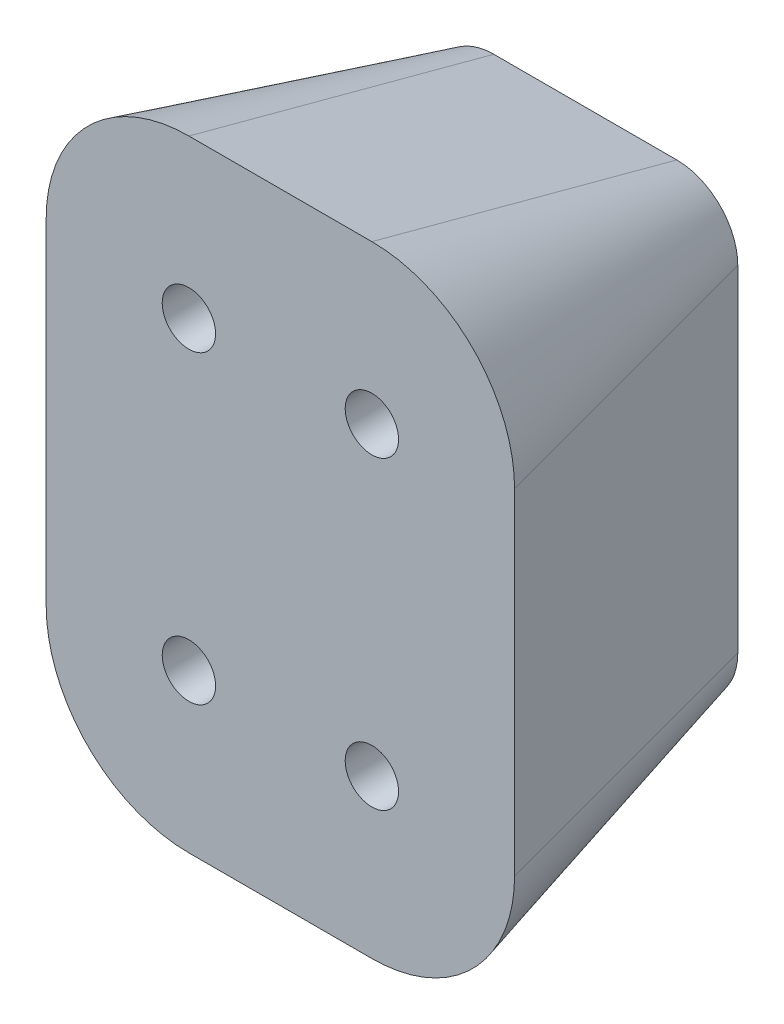
from build123d import *

# Parameters (mm, degrees)
SKETCH1_R           = 1.75
BOSS_EXTRUDE1_DEPTH = 5
BOSS_EXTRUDE2_DEPTH = 20
BOSS_EXTRUDE2_DRAFT = -15
CUT_EXTRUDE1_REACH  = 37.713
SKETCH5_R           = 1.75
CUT_EXTRUDE2_DEPTH  = 5


with BuildPart() as part:
    # Sketch1 → Boss-Extrude1 (new body)
    with BuildSketch(Plane.XY):
        with BuildLine():
            Line((-6, 15), (6, 15))
            ThreePointArc((6, 15), (8.828427125, 13.828427125), (10, 11))
            Line((10, 11), (10, -11))
            ThreePointArc((10, -11), (8.828427125, -13.828427125), (6, -15))
            Line((6, -15), (-6, -15))
            ThreePointArc((-6, -15), (-8.828427125, -13.828427125), (-10, -11))
            Line((-10, -11), (-10, 11))
            ThreePointArc((-10, 11), (-8.828427125, 13.828427125), (-6, 15))
        make_face()
        with Locations((-6, 10)):
            Circle(SKETCH1_R, mode=Mode.SUBTRACT)
        with Locations((6, 10)):
            Circle(SKETCH1_R, mode=Mode.SUBTRACT)
        with Locations((-6, -10)):
            Circle(SKETCH1_R, mode=Mode.SUBTRACT)
        with Locations((6, -10)):
            Circle(SKETCH1_R, mode=Mode.SUBTRACT)
    extrude(amount=BOSS_EXTRUDE1_DEPTH)


with BuildPart() as boss_extrude2_tool:
    # Sketch4 → Boss-Extrude2 (with draft: the straight prism first)
    with BuildSketch(Plane.XY.offset(5)):
        with BuildLine():
            Line((-6, -15), (6, -15))
            ThreePointArc((6, -15), (8.828427125, -13.828427125), (10, -11))
            Line((10, -11), (10, 11))
            ThreePointArc((10, 11), (8.828427125, 13.828427125), (6, 15))
            Line((6, 15), (-6, 15))
            ThreePointArc((-6, 15), (-8.828427125, 13.828427125), (-10, 11))
            Line((-10, 11), (-10, -11))
            ThreePointArc((-10, -11), (-8.828427125, -13.828427125), (-6, -15))
        make_face()
    extrude(amount=BOSS_EXTRUDE2_DEPTH)
    # Boss-Extrude2: the draft: its side faces are tilted about the plane it starts from
    boss_extrude2_sides = [boss_extrude2_tool.faces().sort_by_distance(p)[0] for p in [
        (-10, 0, 15),
        (-8.828427125, -13.828427125, 15),
        (0, -15, 15),
        (8.828427125, -13.828427125, 15),
        (10, 0, 15),
        (8.828427125, 13.828427125, 15),
        (0, 15, 15),
        (-8.828427125, 13.828427125, 15),
    ]]
    draft(boss_extrude2_sides, Plane.XY.offset(5), BOSS_EXTRUDE2_DRAFT)


with BuildPart() as part_1:
    add(part.part)

    # Boss-Extrude2: add boss_extrude2_tool
    add(boss_extrude2_tool.part)

    # Sketch5 → Cut-Extrude1 (cut, up to next)
    with BuildSketch(Plane(origin=(0, 0, 0), x_dir=(-1, 0, 0), z_dir=(0, 0, -1)), mode=Mode.PRIVATE) as cut_extrude1_sk1:
        with Locations(Location((-6, -10, 0), (0, 0, 180))):
            Circle(SKETCH5_R)
    cut_extrude1_tool1 = extrude(cut_extrude1_sk1.sketch, amount=-CUT_EXTRUDE1_REACH, mode=Mode.PRIVATE) & part_1.part
    # Sketch5 → Cut-Extrude1 (cut, up to next)
    with BuildSketch(Plane(origin=(0, 0, 0), x_dir=(-1, 0, 0), z_dir=(0, 0, -1)), mode=Mode.PRIVATE) as cut_extrude1_sk2:
        with Locations(Location((6, -10, 0), (0, 0, 180))):
            Circle(SKETCH5_R)
    cut_extrude1_tool2 = extrude(cut_extrude1_sk2.sketch, amount=-CUT_EXTRUDE1_REACH, mode=Mode.PRIVATE) & part_1.part
    # Sketch5 → Cut-Extrude1 (cut, up to next)
    with BuildSketch(Plane(origin=(0, 0, 0), x_dir=(-1, 0, 0), z_dir=(0, 0, -1)), mode=Mode.PRIVATE) as cut_extrude1_sk3:
        with Locations(Location((6, 10, 0), (0, 0, 180))):
            Circle(SKETCH5_R)
    cut_extrude1_tool3 = extrude(cut_extrude1_sk3.sketch, amount=-CUT_EXTRUDE1_REACH, mode=Mode.PRIVATE) & part_1.part
    # Sketch5 → Cut-Extrude1 (cut, up to next)
    with BuildSketch(Plane(origin=(0, 0, 0), x_dir=(-1, 0, 0), z_dir=(0, 0, -1)), mode=Mode.PRIVATE) as cut_extrude1_sk4:
        with Locations(Location((-6, 10, 0), (0, 0, 180))):
            Circle(SKETCH5_R)
    cut_extrude1_tool4 = extrude(cut_extrude1_sk4.sketch, amount=-CUT_EXTRUDE1_REACH, mode=Mode.PRIVATE) & part_1.part
    add(cut_extrude1_tool1.solids().sort_by_distance((6, -10, 0))[0], mode=Mode.SUBTRACT)
    add(cut_extrude1_tool2.solids().sort_by_distance((-6, -10, 0))[0], mode=Mode.SUBTRACT)
    add(cut_extrude1_tool3.solids().sort_by_distance((-6, 10, 0))[0], mode=Mode.SUBTRACT)
    add(cut_extrude1_tool4.solids().sort_by_distance((6, 10, 0))[0], mode=Mode.SUBTRACT)

    # Sketch6 → Cut-Extrude2 (cut)
    with BuildSketch(Plane(origin=(0, 0, 0), x_dir=(-1, 0, 0), z_dir=(0, 0, -1))):
        with BuildLine():
            Line((6, -15), (-6, -15))
            ThreePointArc((-6, -15), (-8.828427125, -13.828427125), (-10, -11))
            Line((-10, -11), (-10, 11))
            ThreePointArc((-10, 11), (-8.828427125, 13.828427125), (-6, 15))
            Line((-6, 15), (6, 15))
            ThreePointArc((6, 15), (8.828427125, 13.828427125), (10, 11))
            Line((10, 11), (10, -11))
            ThreePointArc((10, -11), (8.828427125, -13.828427125), (6, -15))
        make_face()
    extrude(amount=-CUT_EXTRUDE2_DEPTH, mode=Mode.SUBTRACT)


solid = part_1.part
